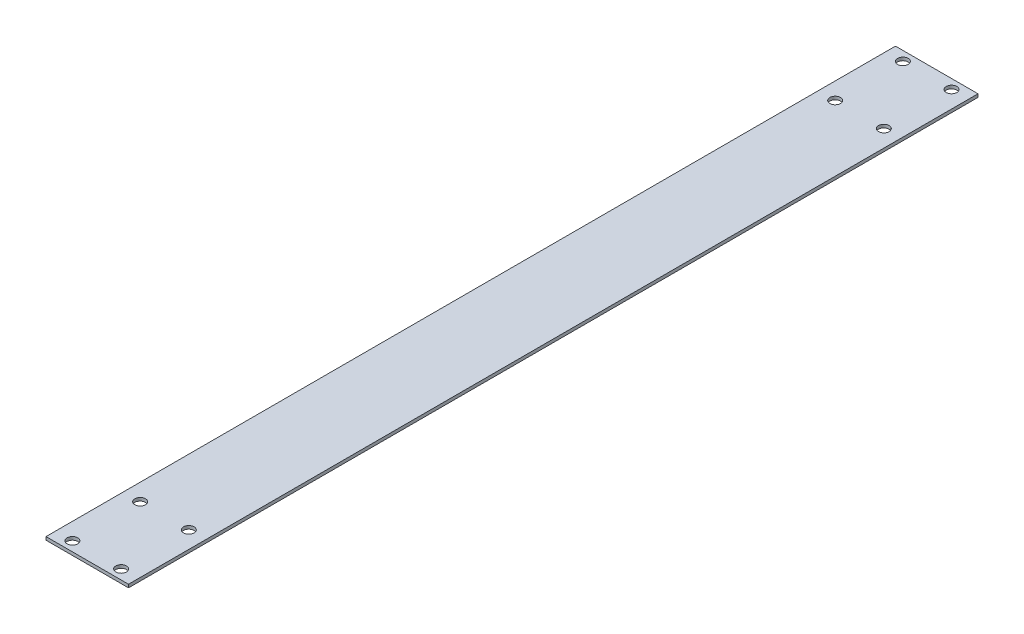
from build123d import *

# Parameters (mm, degrees)
ESQUISSE1_W             = 39
ESQUISSE1_H             = 1.5
BOSS_EXTRU_1_DEPTH      = 401.5
ESQUISSE2_R             = 2.5
ENL_V_MAT_EXTRU_1_DEPTH = 404.392488775


with BuildPart() as part:
    # Esquisse1 → Boss.-Extru.1 (new body)
    with BuildSketch(Plane.XY):
        with Locations((19.5, 0.75)):
            Rectangle(ESQUISSE1_W, ESQUISSE1_H)
    extrude(amount=BOSS_EXTRU_1_DEPTH)

    # Esquisse2 → Enlèv. mat.-Extru.1 (cut, through all)
    with BuildSketch(Plane(origin=(0, 0, 0), x_dir=(1, 0, 0), z_dir=(0, 1, 0))):
        with Locations(Location((8, -397, 0), (0, 0, 270))):
            Circle(ESQUISSE2_R)
        with Locations(Location((31, -365, 0), (0, 0, 270))):
            Circle(ESQUISSE2_R)
        with Locations(Location((31, -36.5, 0), (0, 0, 90))):
            Circle(ESQUISSE2_R)
        with Locations(Location((8, -4.5, 0), (0, 0, 90))):
            Circle(ESQUISSE2_R)
        with Locations(Location((8, -36.5, 0), (0, 0, 270))):
            Circle(ESQUISSE2_R)
        with Locations(Location((31, -4.5, 0), (0, 0, 270))):
            Circle(ESQUISSE2_R)
        with Locations(Location((8, -365, 0), (0, 0, 90))):
            Circle(ESQUISSE2_R)
        with Locations(Location((31, -397, 0), (0, 0, 90))):
            Circle(ESQUISSE2_R)
    extrude(amount=ENL_V_MAT_EXTRU_1_DEPTH, mode=Mode.SUBTRACT)


solid = part.part
